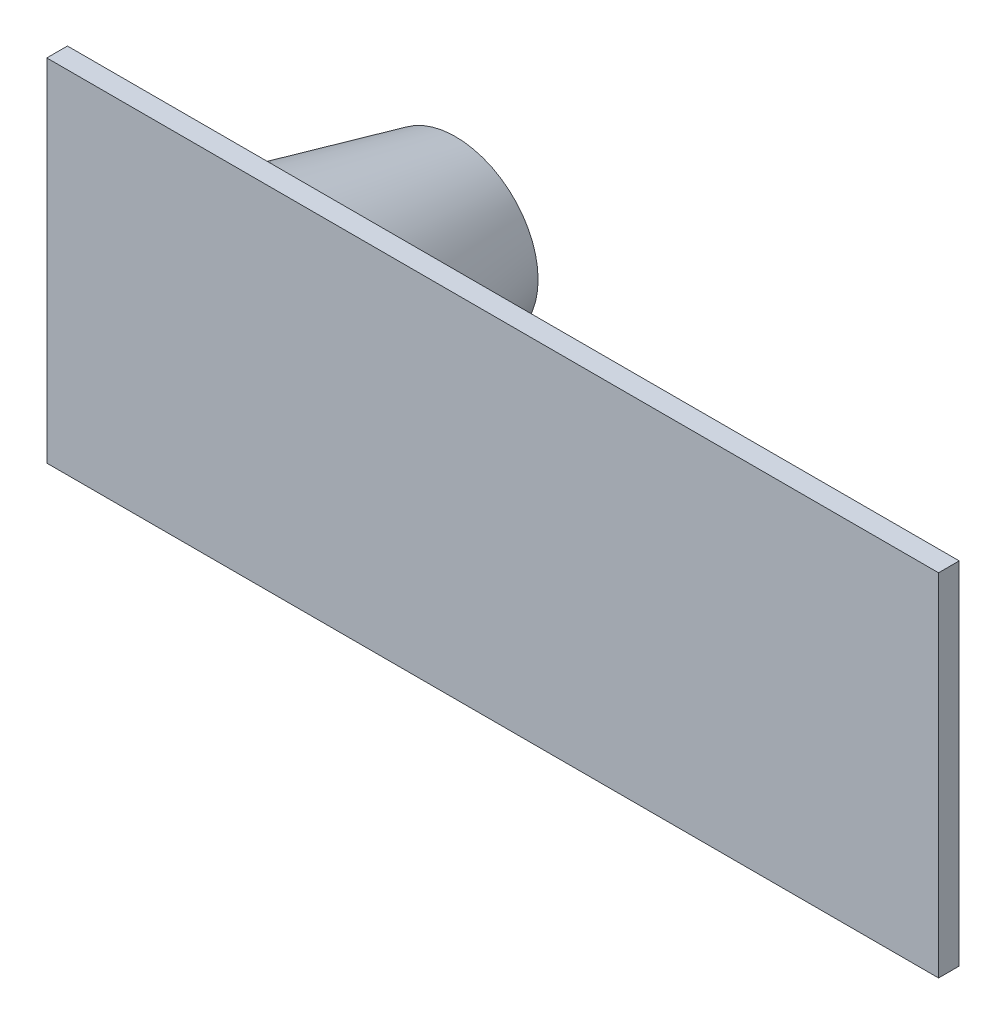
from build123d import *

# Parameters (mm, degrees)
SERIES_PLATE_21_6_X_8_5_X_0_5_SKETCH_W = 21.6
SERIES_PLATE_21_6_X_8_5_X_0_5_SKETCH_H = 0.5
SERIES_PLATE_21_6_X_8_5_X_0_5_DEPTH    = 8.5


with BuildPart() as part:
    # Series Plate 21.6 x 8.5 x 0.5 Sketch → Series Plate 21.6 x 8.5 x 0.5 (new body)
    with BuildSketch(Plane(origin=(0, 1.95, 0), x_dir=(1, 0, 0), z_dir=(0, 1, 0))):
        with Locations((20, 14.9)):
            Rectangle(SERIES_PLATE_21_6_X_8_5_X_0_5_SKETCH_W, SERIES_PLATE_21_6_X_8_5_X_0_5_SKETCH_H)
    extrude(amount=SERIES_PLATE_21_6_X_8_5_X_0_5_DEPTH)

    # Spring (compressed 4.3) Sketch → Spring (compressed 4.3) (revolve)
    with BuildSketch(Plane(origin=(0, 6.95, 0), x_dir=(1, 0, 0), z_dir=(0, 1, 0))):
        Polygon((16.8, 15.15), (17.3, 15.15), (16.3, 19.45), (15.8, 19.45), align=None)
    revolve(axis=Axis((14.3, 6.95, -14.15), (0, 0, -1)))

    # Dimple 0.9 Sketch → Dimple 0.9 (revolve)
    with BuildSketch(Plane(origin=(0, 6.95, 0), x_dir=(1, 0, 0), z_dir=(0, 1, 0))):
        with BuildLine():
            Line((25.7, 15.15), (28.2, 15.15))
            ThreePointArc((28.2, 15.15), (27.028533026, 15.818147293), (25.7, 16.05))
            Line((25.7, 16.05), (25.7, 15.15))
        make_face()
    revolve(axis=Axis((25.7, 6.95, -14.15), (0, 0, -1)))


solid = part.part
